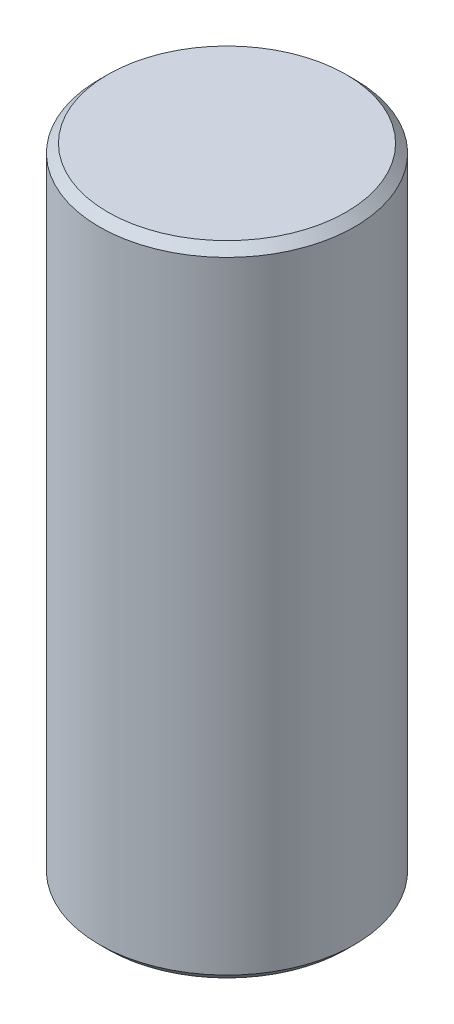
from build123d import *

# Parameters (mm, degrees)
SKETCH_1_R      = 3
EXTRUDE_1_DEPTH = 15
CHAMFER_1_SIZE  = 0.2


with BuildPart() as part:
    # 草图1 → 凸台-拉伸1 (new body)
    with BuildSketch(Plane(origin=(0, 0, 0), x_dir=(1, 0, 0), z_dir=(0, 1, 0))):
        with Locations(Location((0, 0, 0), (0, 0, 270))):
            Circle(SKETCH_1_R)
    extrude(amount=EXTRUDE_1_DEPTH)

    # 倒角1
    chamfer_1_edges = [part.edges().sort_by_distance(p)[0] for p in [
        (0, 0, -3),
        (0, 15, -3),
    ]]
    chamfer(chamfer_1_edges, length=CHAMFER_1_SIZE)


solid = part.part
